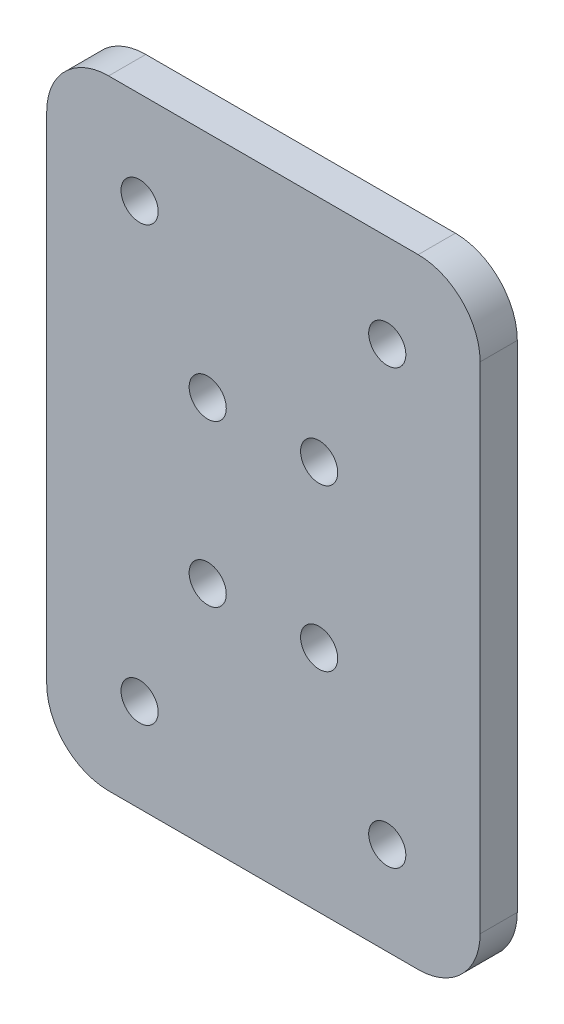
from build123d import *

# Parameters (mm, degrees)
SKETCH_2_W      = 35
SKETCH_2_H      = 50
SKETCH_2_R      = 1.5
EXTRUDE_2_DEPTH = 3
FILLET_2_R      = 5


with BuildPart() as part:
    # 草图2 → 凸台-拉伸2 (new body)
    with BuildSketch(Plane.XY):
        Rectangle(SKETCH_2_W, SKETCH_2_H)
        with Locations((-10, -17.5)):
            Circle(SKETCH_2_R, mode=Mode.SUBTRACT)
        with Locations((10, -17.5)):
            Circle(SKETCH_2_R, mode=Mode.SUBTRACT)
        with Locations((10, 17.5)):
            Circle(SKETCH_2_R, mode=Mode.SUBTRACT)
        with Locations((-10, 17.5)):
            Circle(SKETCH_2_R, mode=Mode.SUBTRACT)
        with Locations((4.5, 6.5)):
            Circle(SKETCH_2_R, mode=Mode.SUBTRACT)
        with Locations((-4.5, 6.5)):
            Circle(SKETCH_2_R, mode=Mode.SUBTRACT)
        with Locations((-4.5, -6.5)):
            Circle(SKETCH_2_R, mode=Mode.SUBTRACT)
        with Locations((4.5, -6.5)):
            Circle(SKETCH_2_R, mode=Mode.SUBTRACT)
    extrude(amount=EXTRUDE_2_DEPTH)

    # 圆角2
    fillet_2_edges = [part.edges().sort_by_distance(p)[0] for p in [
        (17.5, -25, 1.5),
        (-17.5, -25, 1.5),
        (-17.5, 25, 1.5),
        (17.5, 25, 1.5),
    ]]
    fillet(fillet_2_edges, radius=FILLET_2_R)


solid = part.part
